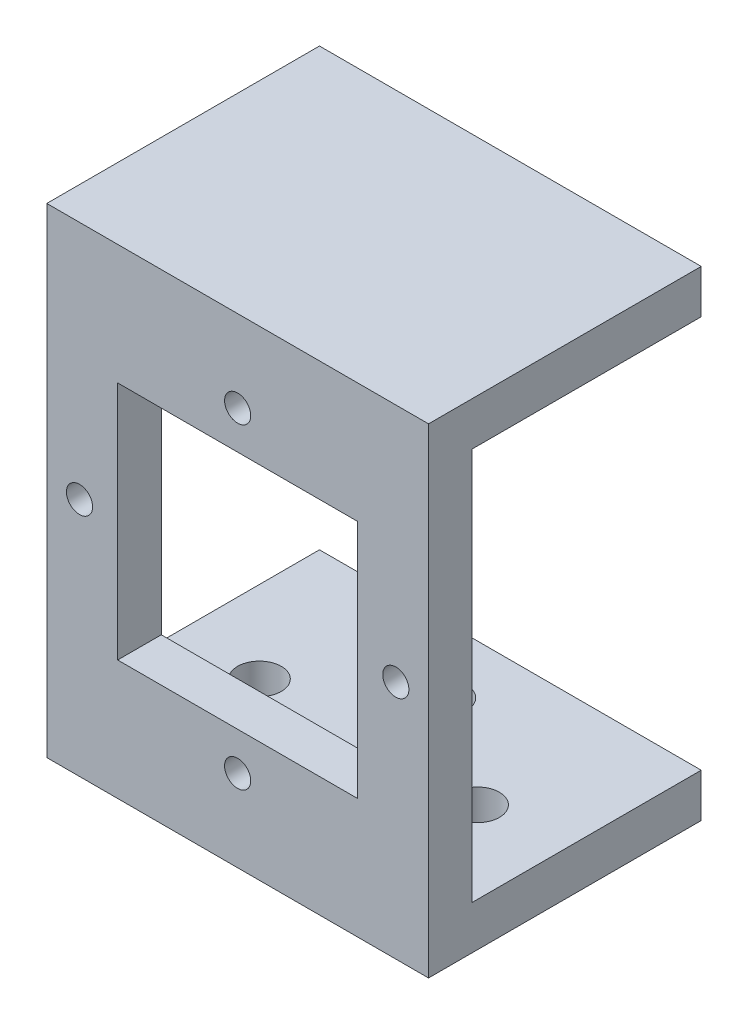
from build123d import *

# Parameters (mm, degrees)
SKETCH_1_R      = 1.2
SKETCH_1_W      = 22
SKETCH_1_H      = 22
EXTRUDE_1_DEPTH = 4
SKETCH_2_W      = 35
SKETCH_2_H      = 25
SKETCH_2_R      = 2
EXTRUDE_2_DEPTH = 4
SKETCH_3_W      = 35
SKETCH_3_H      = 25
EXTRUDE_3_DEPTH = 4


with BuildPart() as part:
    # 草图1 → 凸台-拉伸1 (new body)
    with BuildSketch(Plane.XY):
        Polygon((17.5, 0), (17.5, -18), (-17.5, -18), (-17.5, 0), (-17.5, 18), (17.5, 18), align=None)
        with Locations((0, 14.5)):
            Circle(SKETCH_1_R, mode=Mode.SUBTRACT)
        with Locations((14.5, 0)):
            Circle(SKETCH_1_R, mode=Mode.SUBTRACT)
        with Locations((0, -14.5)):
            Circle(SKETCH_1_R, mode=Mode.SUBTRACT)
        with Locations((-14.5, 0)):
            Circle(SKETCH_1_R, mode=Mode.SUBTRACT)
        Rectangle(SKETCH_1_W, SKETCH_1_H, mode=Mode.SUBTRACT)
    extrude(amount=EXTRUDE_1_DEPTH)

    # 草图2 → 凸台-拉伸2 (add)
    with BuildSketch(Plane.XZ.offset(18)):
        with Locations((0, -8.5)):
            Rectangle(SKETCH_2_W, SKETCH_2_H)
        with Locations((10, -8)):
            Circle(SKETCH_2_R, mode=Mode.SUBTRACT)
        with Locations((0, -15)):
            Circle(SKETCH_2_R, mode=Mode.SUBTRACT)
        with Locations(Location((-10, -8, 0), (0, 0, 180))):
            Circle(SKETCH_2_R, mode=Mode.SUBTRACT)
    extrude(amount=EXTRUDE_2_DEPTH)

    # 草图3 → 凸台-拉伸3 (add)
    with BuildSketch(Plane(origin=(0, 18, 0), x_dir=(1, 0, 0), z_dir=(0, 1, 0))):
        with Locations((0, 8.5)):
            Rectangle(SKETCH_3_W, SKETCH_3_H)
    extrude(amount=EXTRUDE_3_DEPTH)


solid = part.part
